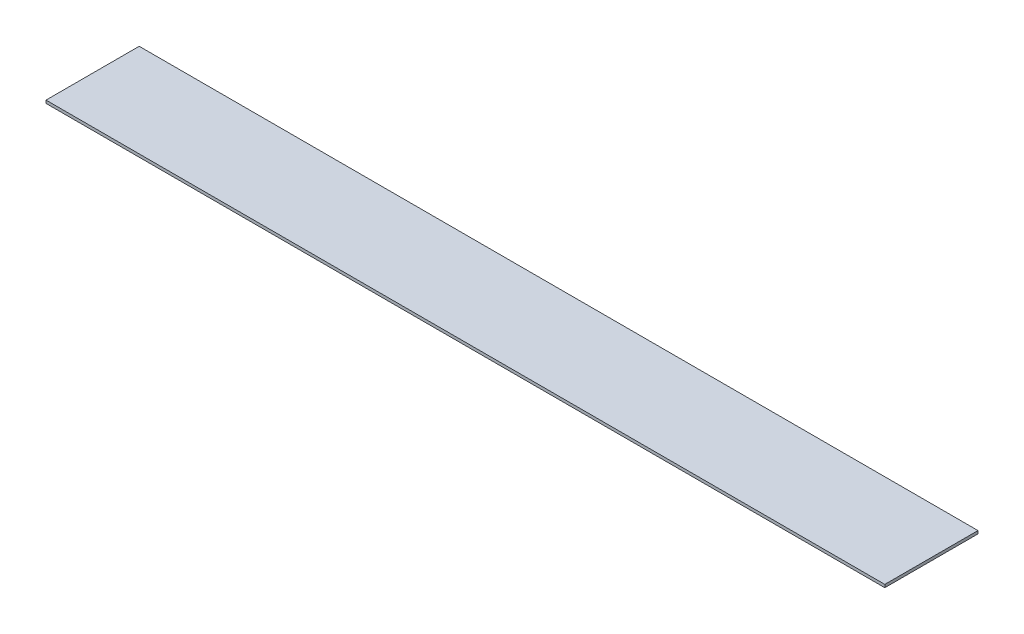
from build123d import *

# Parameters (mm, degrees)
SKETCH1_W           = 457.2
SKETCH1_H           = 50.8
BOSS_EXTRUDE1_DEPTH = 1.5875


with BuildPart() as part:
    # Sketch1 → Boss-Extrude1 (new body)
    with BuildSketch(Plane(origin=(0, 0, 0), x_dir=(1, 0, 0), z_dir=(0, 1, 0))):
        with Locations((-105.347872469, 9.233867996)):
            Rectangle(SKETCH1_W, SKETCH1_H)
    extrude(amount=BOSS_EXTRUDE1_DEPTH)


solid = part.part
